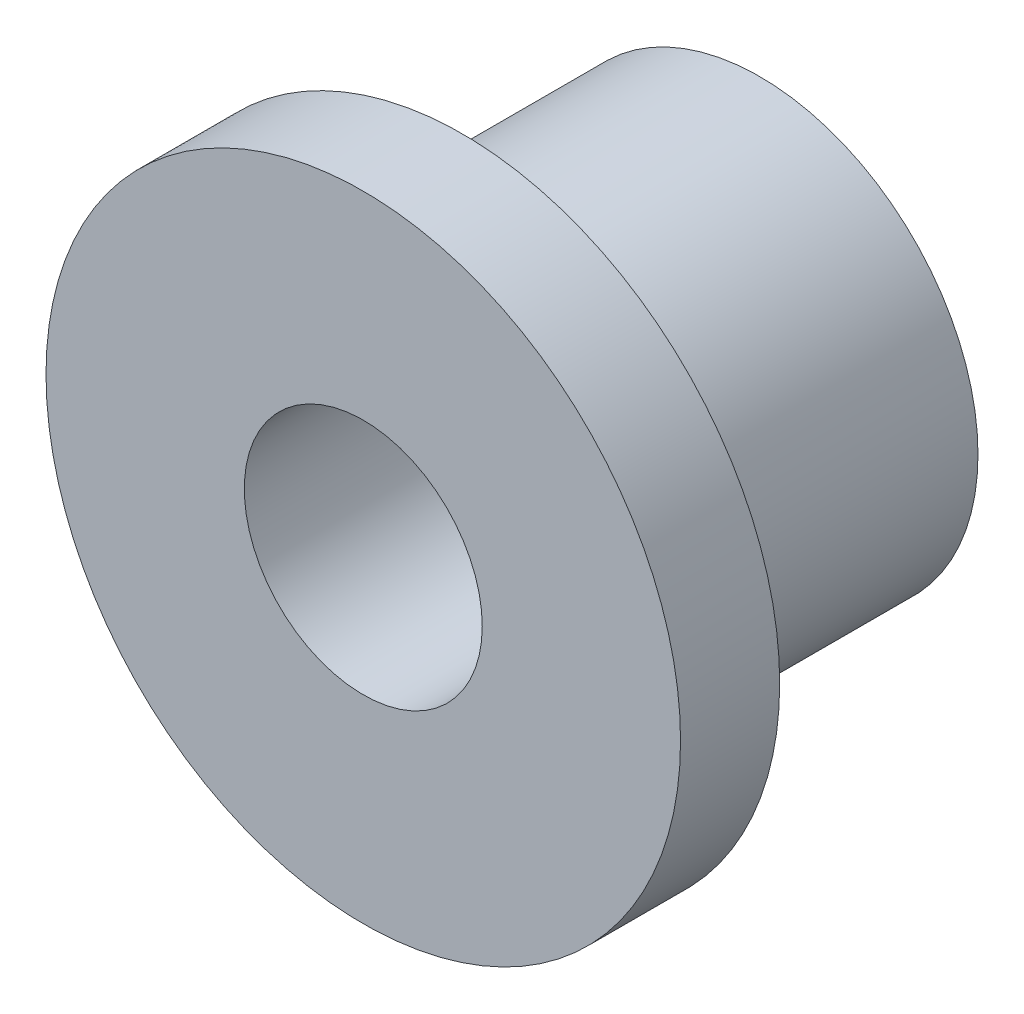
from build123d import *


with BuildPart() as part:
    # Sketch1 → Base-Revolve (revolve)
    with BuildSketch(Plane(origin=(0, 0, 0), x_dir=(0, 0, -1), z_dir=(1, 0, 0))):
        Polygon((-21.744214286, 6), (-21.744214286, 16), (-16.744214286, 16), (-16.744214286, 11), (-1.744214286, 11), (-1.744214286, 6), align=None)
    revolve(axis=Axis((0, 0, 48.885928571), (0, 0, -1)))


solid = part.part
